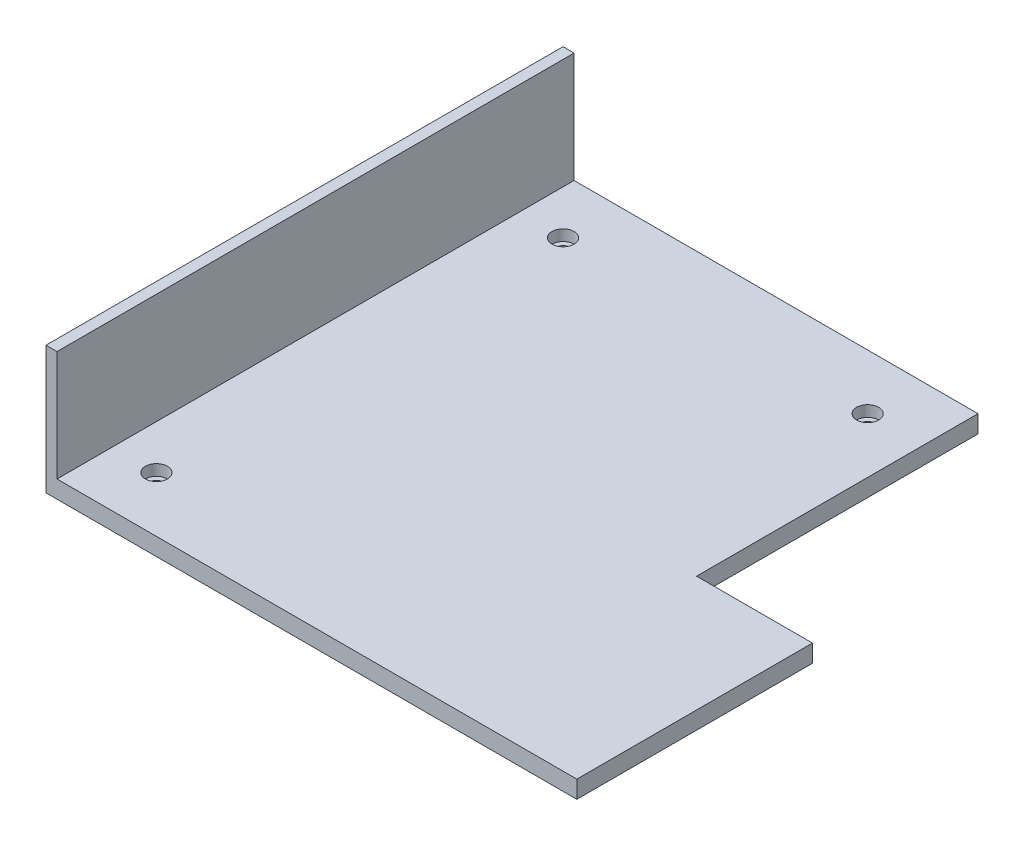
from build123d import *

# Parameters (mm, degrees)
SKETCH1_W                      = 192.4
SKETCH1_H                      = 187.4
BOSS_EXTRUDE1_DEPTH            = 6.35
BOSS_EXTRUDE2_DEPTH            = 40
CUT_EXTRUDE1_REACH             = 142.122
SKETCH4_W                      = 42
SKETCH4_H                      = 102
CBORE_FOR_M4_SHCS1_D           = 4.5
CBORE_FOR_M4_SHCS1_CBORE_D     = 8
CBORE_FOR_M4_SHCS1_CBORE_DEPTH = 4


with BuildPart() as part:
    # Sketch1 → Boss-Extrude1 (new body)
    with BuildSketch(Plane(origin=(0, 0, 0), x_dir=(1, 0, 0), z_dir=(0, 1, 0))):
        Rectangle(SKETCH1_W, SKETCH1_H)
    extrude(amount=BOSS_EXTRUDE1_DEPTH)

    # Sketch2 → Boss-Extrude2 (add)
    with BuildSketch(Plane(origin=(0, 6.35, 0), x_dir=(1, 0, 0), z_dir=(0, 1, 0))):
        Polygon((-92.2, 89.7), (-92.2, -89.7), (-92.2, -93.7), (-96.2, -93.7), (-96.2, 93.7), (-92.2, 93.7), align=None)
    extrude(amount=BOSS_EXTRUDE2_DEPTH)

    # Sketch4 → Cut-Extrude1 (cut, up to next)
    with BuildSketch(Plane(origin=(0, 6.35, 0), x_dir=(1, 0, 0), z_dir=(0, 1, 0)), mode=Mode.PRIVATE) as cut_extrude1_sk1:
        with Locations((75.2, 42.7)):
            Rectangle(SKETCH4_W, SKETCH4_H)
    cut_extrude1_tool1 = extrude(cut_extrude1_sk1.sketch, amount=-CUT_EXTRUDE1_REACH, mode=Mode.PRIVATE) & part.part
    add(cut_extrude1_tool1.solids().sort_by_distance((75.2, 6.35, -42.7))[0], mode=Mode.SUBTRACT)

    # CBORE for M4 SHCS1 (through all)
    with Locations(Plane(origin=(0, 6.35, 0), x_dir=(1, 0, 0), z_dir=(0, 1, 0))):
        with Locations((34.2, 73.7), (-76.2, 73.7), (-76.2, -73.7)):
            CounterBoreHole(CBORE_FOR_M4_SHCS1_D / 2, CBORE_FOR_M4_SHCS1_CBORE_D / 2, CBORE_FOR_M4_SHCS1_CBORE_DEPTH)


solid = part.part
